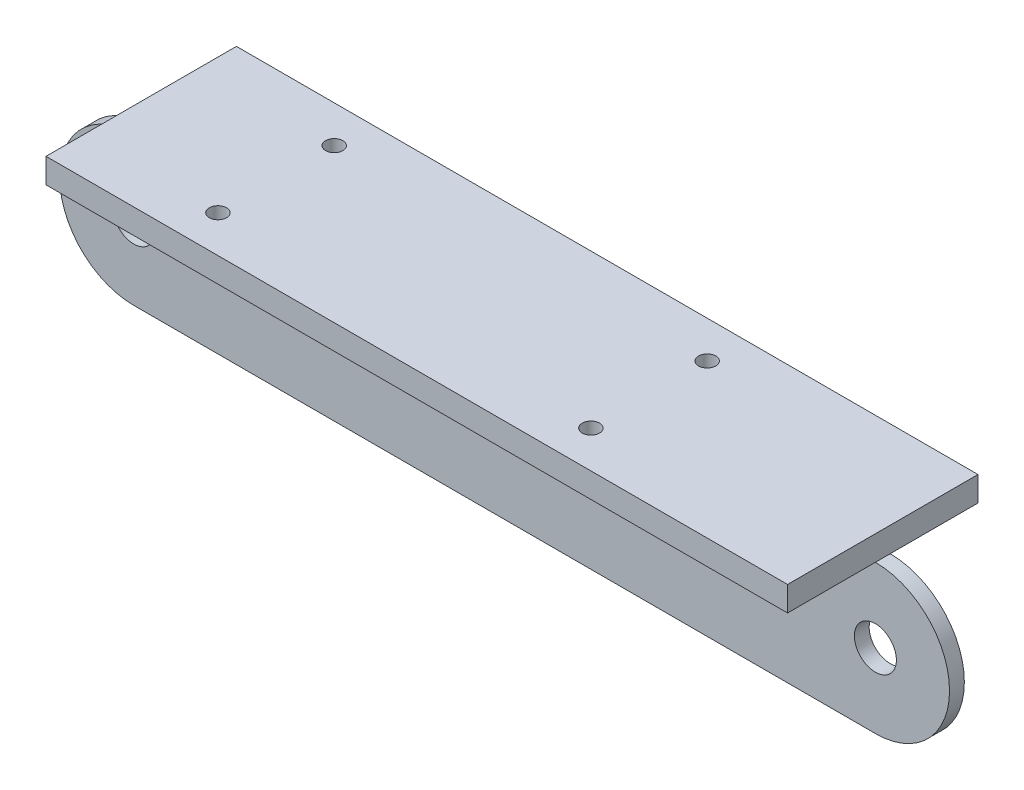
from build123d import *

# Parameters (mm, degrees)
ESBO_O1_R                = 4.25
RESSALTO_EXTRUS_O1_DEPTH = 3
ESBO_O2_W                = 150
ESBO_O2_H                = 38.52
RESSALTO_EXTRUS_O2_DEPTH = 5
RESSALTO_EXTRUS_O3_START = -25
RESSALTO_EXTRUS_O3_DEPTH = 100
ESBO_O4_R                = 1.75
CORTE_EXTRUS_O1_DEPTH    = 10


with BuildPart() as part:
    # Esboço1 → Ressalto-extrusão1 (new body)
    with BuildSketch(Plane.XY):
        with BuildLine():
            Line((-85.207100592, 26.183431953), (64.792899408, 26.183431953))
            ThreePointArc((64.792899408, 26.183431953), (79.792899408, 11.183431953), (64.792899408, -3.816568047))
            Line((64.792899408, -3.816568047), (-85.207100592, -3.816568047))
            ThreePointArc((-85.207100592, -3.816568047), (-100.207100592, 11.183431953), (-85.207100592, 26.183431953))
        make_face()
        with Locations((-85.207100592, 11.183431953)):
            Circle(ESBO_O1_R, mode=Mode.SUBTRACT)
        with Locations((64.792899408, 11.183431953)):
            Circle(ESBO_O1_R, mode=Mode.SUBTRACT)
    extrude(amount=RESSALTO_EXTRUS_O1_DEPTH)

    # Esboço2 → Ressalto-extrusão2 (add)
    with BuildSketch(Plane(origin=(0, 26.183431953, 0), x_dir=(1, 0, 0), z_dir=(0, 1, 0))):
        with Locations((-10.207100592, -1.5)):
            Rectangle(ESBO_O2_W, ESBO_O2_H)
    extrude(amount=RESSALTO_EXTRUS_O2_DEPTH)

    # Esboço3 → Ressalto-extrusão3 (add)
    with BuildSketch(Plane.ZY.offset(85.207100592).offset(RESSALTO_EXTRUS_O3_START)):
        Polygon((3, 19.683431953), (9.5, 26.183431953), (3, 26.183431953), align=None)
        Polygon((0, 26.183431953), (0, 19.683431953), (-6.5, 26.183431953), align=None)
    extrude(amount=-RESSALTO_EXTRUS_O3_DEPTH)

    # Esboço4 → Corte-extrusão1 (cut)
    with BuildSketch(Plane(origin=(0, 31.183431953, 0), x_dir=(1, 0, 0), z_dir=(0, 1, 0))):
        with Locations(Location((17.512899408, 10.26, 0), (0, 0, 270))):
            Circle(ESBO_O4_R)
        with Locations(Location((17.512899408, -13.26, 0), (0, 0, 270))):
            Circle(ESBO_O4_R)
        with Locations(Location((-57.927100592, -13.26, 0), (0, 0, 270))):
            Circle(ESBO_O4_R)
        with Locations(Location((-57.927100592, 10.26, 0), (0, 0, 270))):
            Circle(ESBO_O4_R)
    extrude(amount=-CORTE_EXTRUS_O1_DEPTH, mode=Mode.SUBTRACT)


solid = part.part
